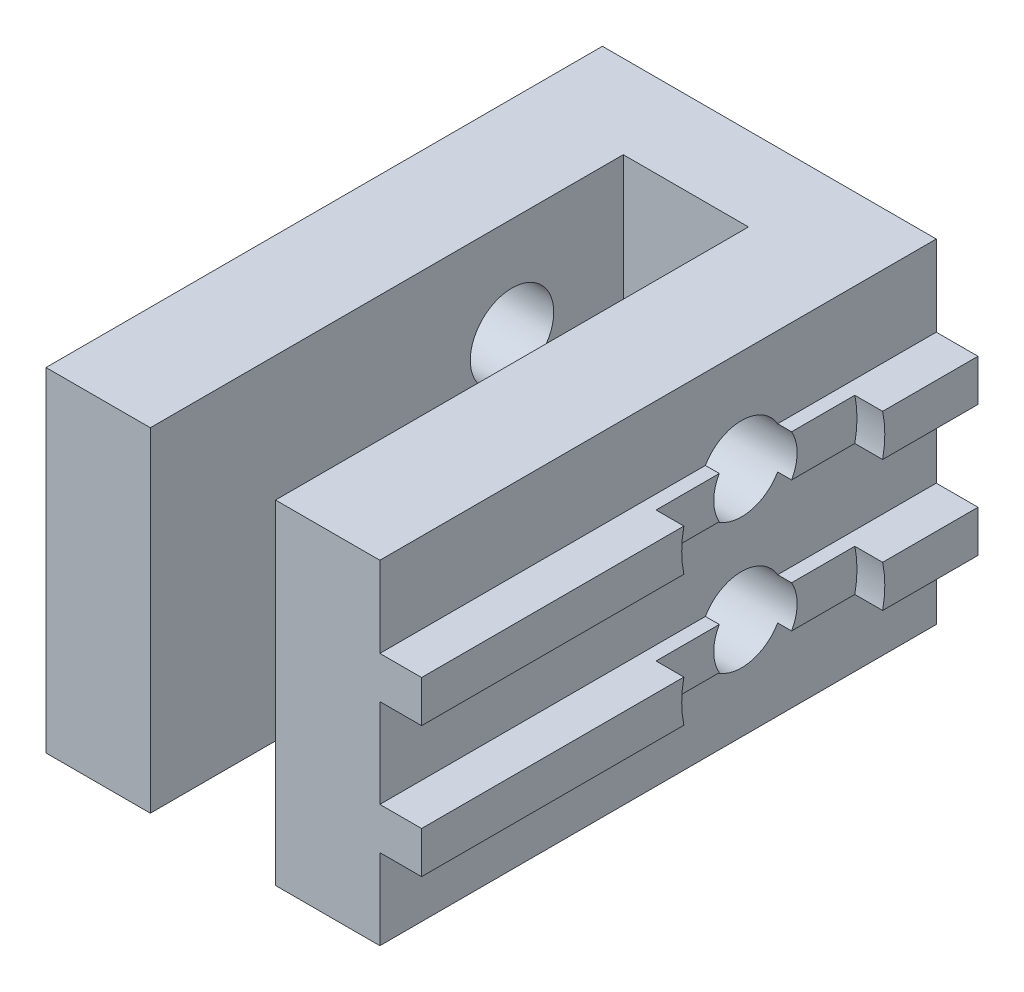
from build123d import *

# Parameters (mm, degrees)
BOSS_EXTRUDE1_DEPTH = 20
SKETCH2_W           = 4.5
SKETCH2_H           = 12
CUT_EXTRUDE1_DEPTH  = 17
SKETCH3_R           = 1.5
CUT_EXTRUDE2_DEPTH  = 1
SKETCH3_3_R         = 1.5
CUT_EXTRUDE3_DEPTH  = 27.949025956


with BuildPart() as part:
    # Sketch1 → Boss-Extrude1 (new body)
    with BuildSketch(Plane.XY):
        Polygon((12, 9.1), (13.5, 9.1), (13.5, 7.6), (12, 7.6), (12, 4.4), (13.5, 4.4), (13.5, 2.9), (12, 2.9), (12, 0), (0, 0), (0, 12), (12, 12), align=None)
    extrude(amount=BOSS_EXTRUDE1_DEPTH)

    # Sketch2 → Cut-Extrude1 (cut)
    with BuildSketch(Plane.XY.offset(20)):
        with Locations((6, 6)):
            Rectangle(SKETCH2_W, SKETCH2_H)
    extrude(amount=-CUT_EXTRUDE1_DEPTH, mode=Mode.SUBTRACT)

    # Sketch3 → Cut-Extrude2 (cut)
    with BuildSketch(Plane(origin=(13.5, 0, 0), x_dir=(0, 0, -1), z_dir=(1, 0, 0))):
        with BuildLine():
            ThreePointArc((-9.792848009, 6), (-7, 0), (-4.207151991, 6))
            ThreePointArc((-4.207151991, 6), (-7, 12), (-9.792848009, 6))
        make_face()
        with Locations((-7, 8.35)):
            Circle(SKETCH3_R, mode=Mode.SUBTRACT)
        with Locations((-7, 3.65)):
            Circle(SKETCH3_R, mode=Mode.SUBTRACT)
    extrude(amount=-CUT_EXTRUDE2_DEPTH, mode=Mode.SUBTRACT)

    # Sketch3<3> → Cut-Extrude3 (cut, through all)
    with BuildSketch(Plane(origin=(13.5, 0, 0), x_dir=(0, 0, -1), z_dir=(1, 0, 0))):
        with Locations((-7, 8.35)):
            Circle(SKETCH3_3_R)
        with Locations((-7, 3.65)):
            Circle(SKETCH3_3_R)
    extrude(amount=-CUT_EXTRUDE3_DEPTH, mode=Mode.SUBTRACT)


solid = part.part
